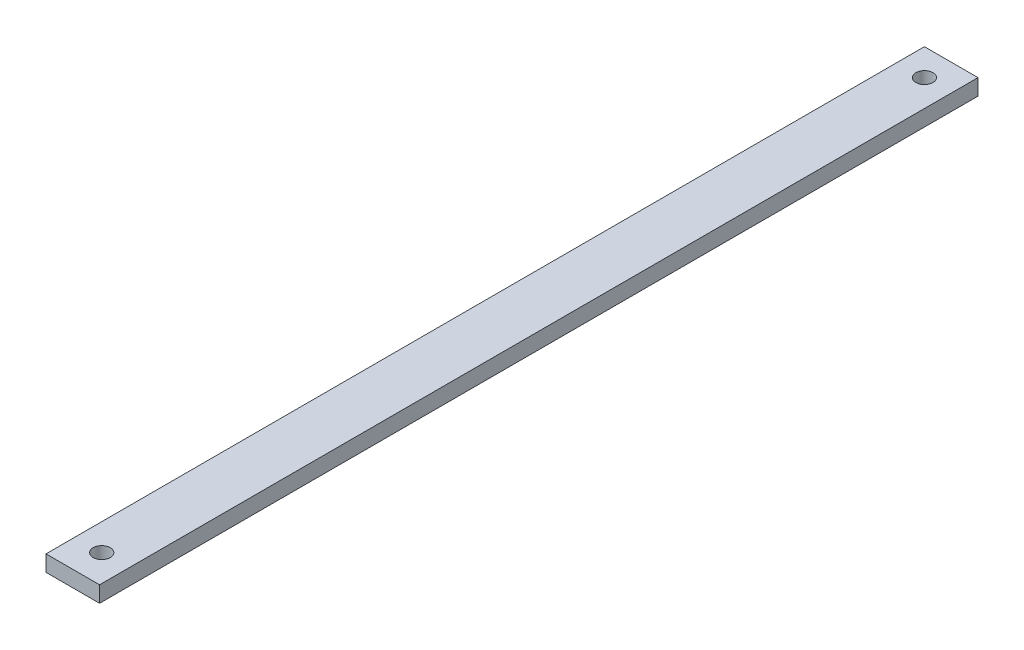
from build123d import *

# Parameters (mm, degrees)
SKETCH1_W           = 10
SKETCH1_H           = 164
BOSS_EXTRUDE1_DEPTH = 3
SKETCH2_R           = 1.6
CUT_EXTRUDE1_DEPTH  = 10


with BuildPart() as part:
    # Sketch1 → Boss-Extrude1 (new body)
    with BuildSketch(Plane(origin=(0, 0, 0), x_dir=(1, 0, 0), z_dir=(0, 1, 0))):
        with Locations((5, 82)):
            Rectangle(SKETCH1_W, SKETCH1_H)
    extrude(amount=BOSS_EXTRUDE1_DEPTH)

    # Sketch2 → Cut-Extrude1 (cut)
    with BuildSketch(Plane(origin=(0, 3, 0), x_dir=(1, 0, 0), z_dir=(0, 1, 0))):
        with Locations(Location((5, 159, 0), (0, 0, 270))):
            Circle(SKETCH2_R)
        with Locations(Location((5, 5.4, 0), (0, 0, 270))):
            Circle(SKETCH2_R)
    extrude(amount=-CUT_EXTRUDE1_DEPTH, mode=Mode.SUBTRACT)


solid = part.part
